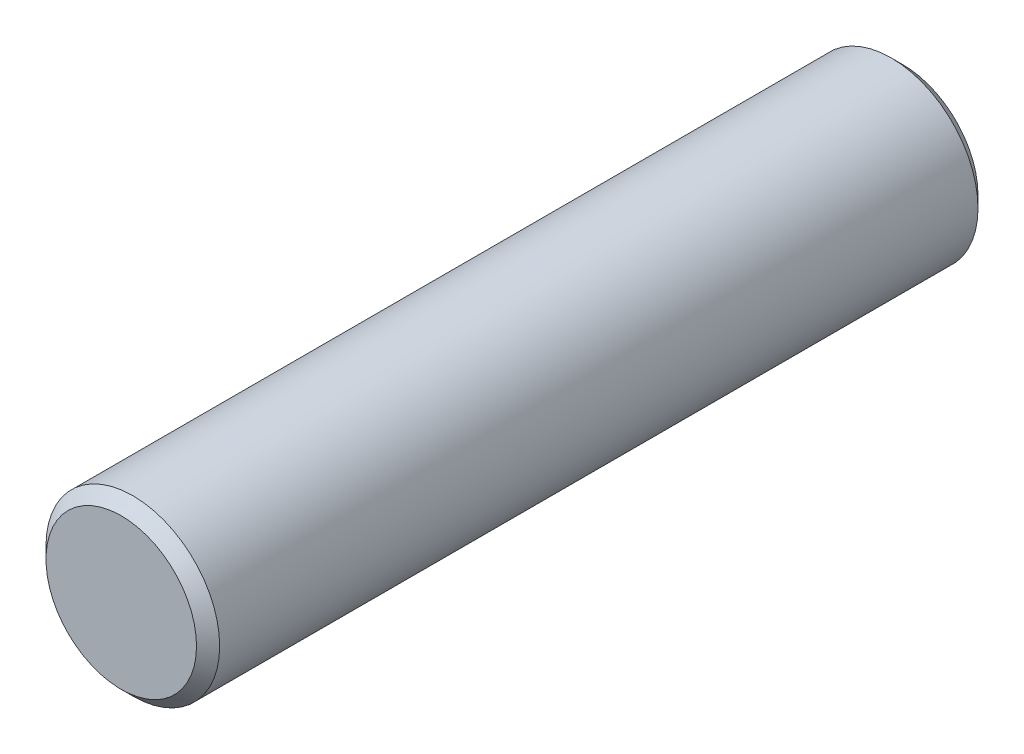
from build123d import *

# Parameters (mm, degrees)
SKETCH1_R           = 1.5
BOSS_EXTRUDE2_DEPTH = 13.5
CHAMFER1_SIZE       = 0.2
CHAMFER2_SIZE       = 0.2


with BuildPart() as part:
    # Sketch1 → Boss-Extrude2 (new body)
    with BuildSketch(Plane.XY):
        Circle(SKETCH1_R)
    extrude(amount=BOSS_EXTRUDE2_DEPTH)

    # Chamfer1
    chamfer1_edges = [part.edges().sort_by_distance(p)[0] for p in [
        (-1.5, 0, 13.5),
    ]]
    chamfer(chamfer1_edges, length=CHAMFER1_SIZE)

    # Chamfer2
    chamfer2_edges = [part.edges().sort_by_distance(p)[0] for p in [
        (-1.5, 0, 0),
    ]]
    chamfer(chamfer2_edges, length=CHAMFER2_SIZE)


solid = part.part
